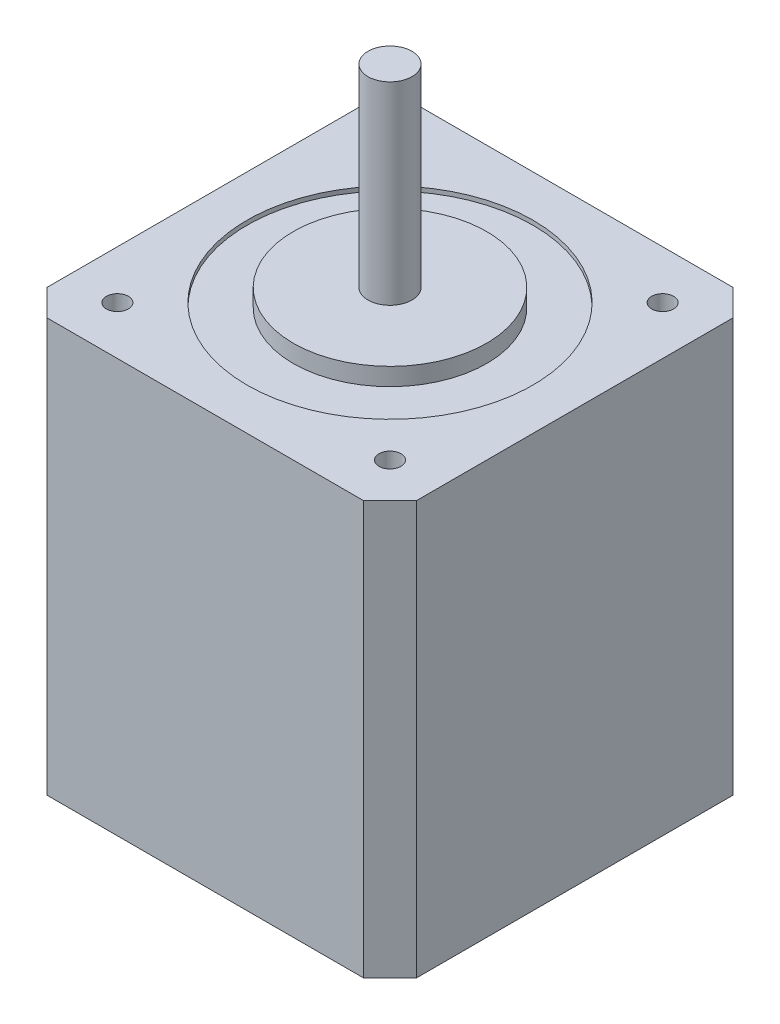
from build123d import *

# Parameters (mm, degrees)
SKETCH_1_W             = 42
SKETCH_1_H             = 42
EXTRUDE_1_DEPTH        = 47
SKETCH_2_R             = 16.25
CUT_EXTRUDE_1_DEPTH    = 0.5
SKETCH_3_R             = 11
EXTRUDE_2_DEPTH        = 2
SKETCH_4_R             = 2.5
EXTRUDE_3_DEPTH        = 22
CHAMFER_1_SIZE         = 3
HOLE_WIZARD_M3_1_D     = 2.5
HOLE_WIZARD_M3_1_DEPTH = 7.5
HOLE_WIZARD_M3_1_TIP   = 0.751075774


with BuildPart() as part:
    # 草圖1 → 填料-伸長1 (new body)
    with BuildSketch(Plane(origin=(0, 0, 0), x_dir=(1, 0, 0), z_dir=(0, 1, 0))):
        Rectangle(SKETCH_1_W, SKETCH_1_H)
    extrude(amount=EXTRUDE_1_DEPTH)

    # 草圖2 → 除料-伸長1 (cut)
    with BuildSketch(Plane(origin=(0, 47, 0), x_dir=(1, 0, 0), z_dir=(0, 1, 0))):
        with Locations(Location((0, 0, 0), (0, 0, 270))):
            Circle(SKETCH_2_R)
    extrude(amount=-CUT_EXTRUDE_1_DEPTH, mode=Mode.SUBTRACT)

    # 草圖3 → 填料-伸長2 (add)
    with BuildSketch(Plane(origin=(0, 46.5, 0), x_dir=(1, 0, 0), z_dir=(0, 1, 0))):
        with Locations(Location((0, 0, 0), (0, 0, 270))):
            Circle(SKETCH_3_R)
    extrude(amount=EXTRUDE_2_DEPTH)

    # 草圖4 → 填料-伸長3 (add)
    with BuildSketch(Plane(origin=(0, 48.5, 0), x_dir=(1, 0, 0), z_dir=(0, 1, 0))):
        with Locations(Location((0, 0, 0), (0, 0, 270))):
            Circle(SKETCH_4_R)
    extrude(amount=EXTRUDE_3_DEPTH)

    # 導角1
    chamfer_1_edges = [part.edges().sort_by_distance(p)[0] for p in [
        (21, 23.5, 21),
        (-21, 23.5, 21),
        (-21, 23.5, -21),
        (21, 23.5, -21),
    ]]
    chamfer(chamfer_1_edges, length=CHAMFER_1_SIZE)

    # M3 螺紋孔1
    with Locations(Plane(origin=(0, 47, 0), x_dir=(1, 0, 0), z_dir=(0, 1, 0))):
        with Locations((-15.5, 15.5), (-15.5, -15.5), (15.5, 15.5), (15.5, -15.5)):
            Hole(HOLE_WIZARD_M3_1_D / 2, depth=HOLE_WIZARD_M3_1_DEPTH)
            with Locations((0, 0, -(HOLE_WIZARD_M3_1_DEPTH + HOLE_WIZARD_M3_1_TIP / 2))):  # 118° drill point
                Cone(0, HOLE_WIZARD_M3_1_D / 2, HOLE_WIZARD_M3_1_TIP, mode=Mode.SUBTRACT)


solid = part.part
